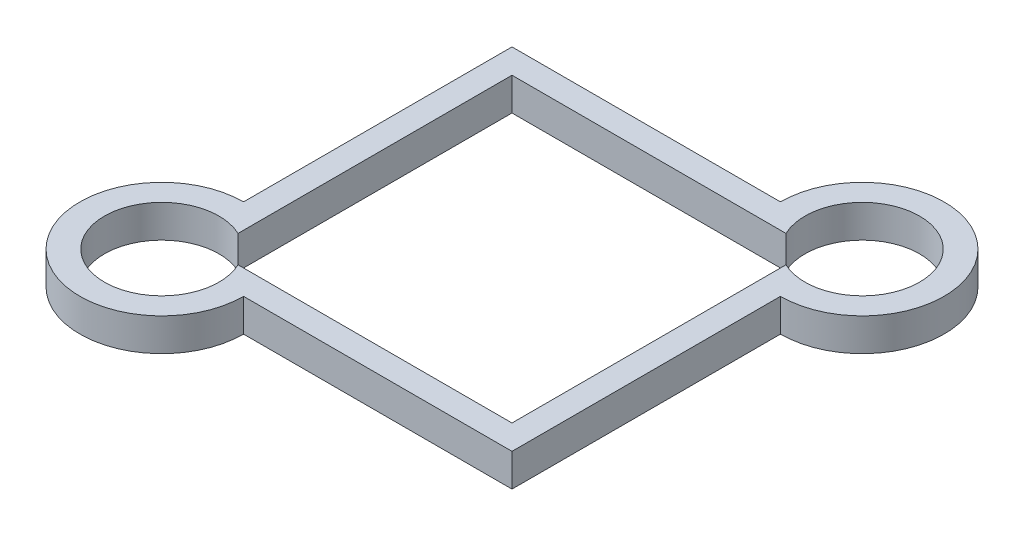
from build123d import *

# Parameters (mm, degrees)
BOSS_EXTRUDE1_DEPTH = 20


with BuildPart() as part:
    # Sketch1 → Boss-Extrude1 (new body)
    with BuildSketch(Plane(origin=(0, 0, 0), x_dir=(1, 0, 0), z_dir=(0, 1, 0))):
        with BuildLine():
            Line((0, 214), (0, 50))
            ThreePointArc((0, 50), (-35.355339059, -35.355339059), (50, 0))
            Line((50, 0), (214, 0))
            Line((214, 0), (214, 164))
            ThreePointArc((214, 164), (249.355339059, 249.355339059), (164, 214))
            Line((164, 214), (0, 214))
        make_face()
        with BuildLine():
            Line((15, 199), (15, 31.622776602))
            ThreePointArc((15, 31.622776602), (-24.748737342, -24.748737342), (31.622776602, 15))
            Line((31.622776602, 15), (199, 15))
            Line((199, 15), (199, 182.377223398))
            ThreePointArc((199, 182.377223398), (238.748737342, 238.748737342), (182.377223398, 199))
            Line((182.377223398, 199), (15, 199))
        make_face(mode=Mode.SUBTRACT)
    extrude(amount=BOSS_EXTRUDE1_DEPTH)


solid = part.part
